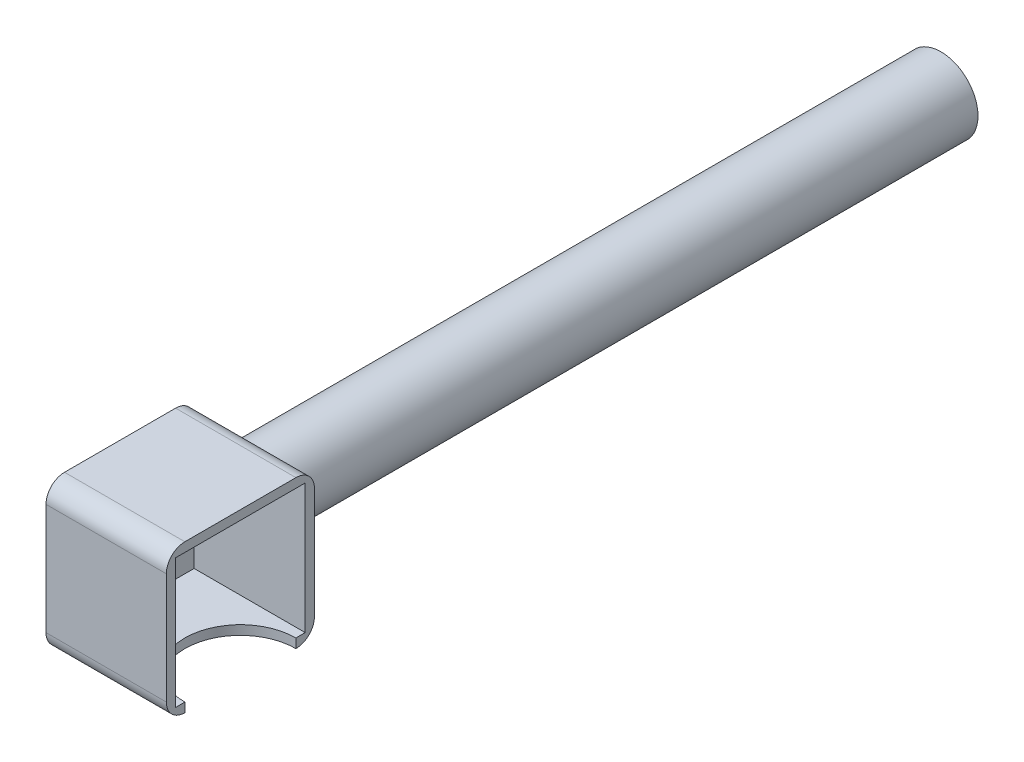
from build123d import *

# Parameters (mm, degrees)
SKETCH2_R           = 10
BOSS_EXTRUDE1_DEPTH = 199.71
CUT_EXTRUDE2_DEPTH  = 4.55
SKETCH5_W           = 32.5
SKETCH5_H           = 40
BOSS_EXTRUDE2_DEPTH = 40
SKETCH10_W          = 35
SKETCH10_H          = 35
CUT_EXTRUDE3_DEPTH  = 30
SKETCH11_W          = 20
SKETCH11_H          = 15
CUT_EXTRUDE4_DEPTH  = 2.5
FILLET1_R           = 5
SKETCH12_R          = 5
CUT_EXTRUDE5_DEPTH  = 199.71
SKETCH2_2_R         = 10
CUT_EXTRUDE6_DEPTH  = 8
BOSS_EXTRUDE3_DEPTH = 1
SKETCH16_R          = 15
CUT_EXTRUDE7_DEPTH  = 10


with BuildPart() as part:
    # Sketch2 → Boss-Extrude1 (new body)
    with BuildSketch(Plane.XY):
        Circle(SKETCH2_R)
    extrude(amount=BOSS_EXTRUDE1_DEPTH)

    # Sketch4 → Cut-Extrude2 (cut)
    with BuildSketch(Plane(origin=(0, -10, 0), x_dir=(-1, 0, 0), z_dir=(0, -1, 0))):
        with BuildLine():
            Line((-4.55, -23.788408852), (-4.55, -4.788408852))
            Line((-4.55, -4.788408852), (4.55, -4.788408852))
            Line((4.55, -4.788408852), (4.55, -23.788408852))
            ThreePointArc((4.55, -23.788408852), (6.2, -28), (4.55, -32.211591148))
            Line((4.55, -32.211591148), (4.55, -51.211591148))
            Line((4.55, -51.211591148), (-4.55, -51.211591148))
            Line((-4.55, -51.211591148), (-4.55, -32.211591148))
            ThreePointArc((-4.55, -32.211591148), (-6.2, -28), (-4.55, -23.788408852))
        make_face()
    extrude(amount=-CUT_EXTRUDE2_DEPTH, mode=Mode.SUBTRACT)

    # Sketch5 → Boss-Extrude2 (add)
    with BuildSketch(Plane.XY.offset(199.71)):
        with Locations((6.25, 0)):
            Rectangle(SKETCH5_W, SKETCH5_H)
    extrude(amount=BOSS_EXTRUDE2_DEPTH)

    # Sketch10 → Cut-Extrude3 (cut)
    with BuildSketch(Plane(origin=(22.5, 0, 0), x_dir=(0, 0, -1), z_dir=(1, 0, 0))):
        with Locations((-219.71, 0)):
            Rectangle(SKETCH10_W, SKETCH10_H)
    extrude(amount=-CUT_EXTRUDE3_DEPTH, mode=Mode.SUBTRACT)

    # Sketch11 → Cut-Extrude4 (cut)
    with BuildSketch(Plane(origin=(-7.5, 0, 0), x_dir=(0, 0, -1), z_dir=(1, 0, 0))):
        with Locations((-219.71, 0)):
            Rectangle(SKETCH11_W, SKETCH11_H)
    extrude(amount=-CUT_EXTRUDE4_DEPTH, mode=Mode.SUBTRACT)

    # Fillet1
    fillet1_edges = [part.edges().sort_by_distance(p)[0] for p in [
        (6.25, 20, 199.71),
        (6.25, -20, 199.71),
        (6.25, 20, 239.71),
        (6.25, -20, 239.71),
    ]]
    fillet(fillet1_edges, radius=FILLET1_R)

    # Sketch12 → Cut-Extrude5 (cut)
    with BuildSketch(Plane(origin=(0, 0, 0), x_dir=(-1, 0, 0), z_dir=(0, 0, -1))):
        Circle(SKETCH12_R)
    extrude(amount=-CUT_EXTRUDE5_DEPTH, mode=Mode.SUBTRACT)

    # Sketch2<2> → Cut-Extrude6 (cut)
    with BuildSketch(Plane.XY):
        with Locations(Location((0, 0, 0), (0, 0, 180))):
            Circle(SKETCH2_2_R)
    extrude(amount=CUT_EXTRUDE6_DEPTH, mode=Mode.SUBTRACT)

    # Sketch15 → Boss-Extrude3 (add)
    with BuildSketch(Plane(origin=(0, 0, 8), x_dir=(-1, 0, 0), z_dir=(0, 0, -1))):
        with BuildLine():
            Line((4.55, -8.904914374), (4.55, -5.45))
            Line((4.55, -5.45), (-4.55, -5.45))
            Line((-4.55, -5.45), (-4.55, -8.904914374))
            ThreePointArc((-4.55, -8.904914374), (0, -10), (4.55, -8.904914374))
        make_face()
    extrude(amount=-BOSS_EXTRUDE3_DEPTH)

    # Sketch16 → Cut-Extrude7 (cut)
    with BuildSketch(Plane.XZ.offset(20)):
        with Locations((22.5, 219.71)):
            Circle(SKETCH16_R)
    extrude(amount=-CUT_EXTRUDE7_DEPTH, mode=Mode.SUBTRACT)


solid = part.part
